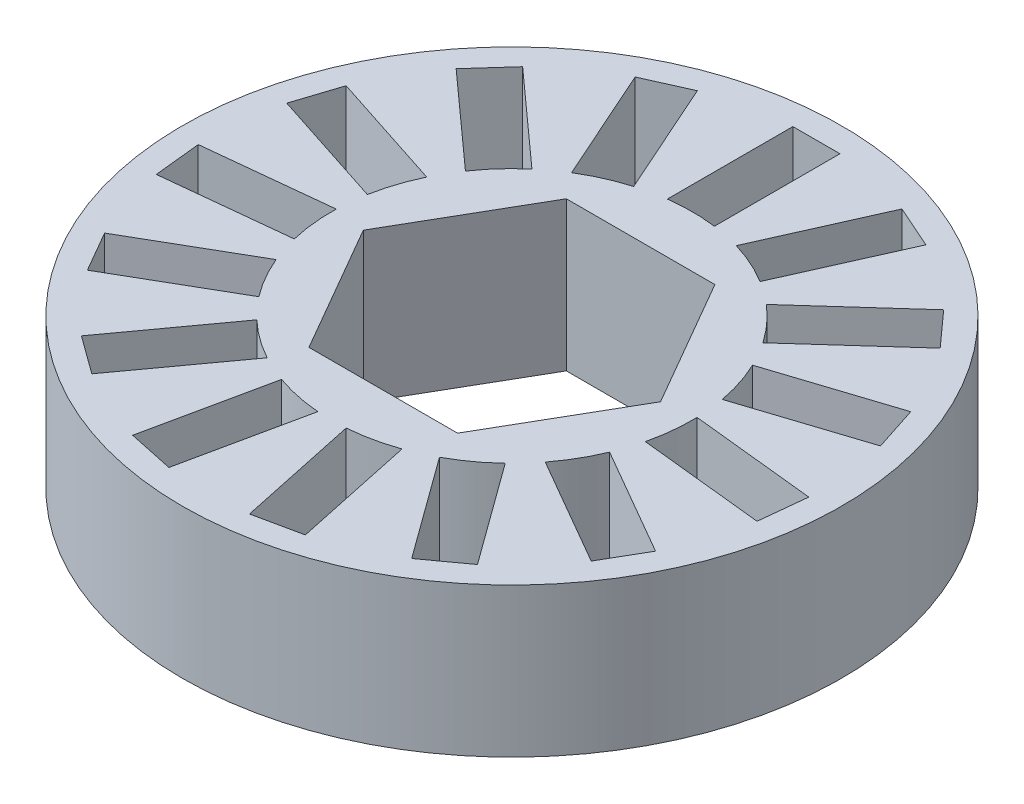
from build123d import *

# Parameters (mm, degrees)
SKETCH1_R           = 10.5
BOSS_EXTRUDE1_DEPTH = 4.75
CUT_EXTRUDE1_DEPTH  = 5
CIRPATTERN1_COUNT   = 15


with BuildPart() as part:
    # Sketch1 → Boss-Extrude1 (new body)
    with BuildSketch(Plane(origin=(0, 0, 0), x_dir=(1, 0, 0), z_dir=(0, 1, 0))):
        with Locations(Location((0, 0, 0), (0, 0, 270))):
            Circle(SKETCH1_R)
        Polygon((4.734272207, 0), (2.367136104, 4.1), (-2.367136104, 4.1), (-4.734272207, 0), (-2.367136104, -4.1), (2.367136104, -4.1), align=None, mode=Mode.SUBTRACT)
    extrude(amount=BOSS_EXTRUDE1_DEPTH)

    # Sketch2 → Cut-Extrude1 (cut)
    with BuildSketch(Plane(origin=(0, 4.75, 0), x_dir=(1, 0, 0), z_dir=(0, 1, 0))):
        with BuildLine():
            Line((0, 5.75), (0, 9.700877125))
            Line((0, 9.700877125), (-0.75, 9.700877125))
            Line((-0.75, 9.700877125), (-0.75, 5.700877125))
            ThreePointArc((-0.75, 5.700877125), (-0.375803491, 5.737706139), (0, 5.75))
        make_face()
        with BuildLine():
            Line((0.75, 9.700877125), (0, 9.700877125))
            Line((0, 9.700877125), (0, 5.75))
            ThreePointArc((0, 5.75), (0.375803491, 5.737706139), (0.75, 5.700877125))
            Line((0.75, 5.700877125), (0.75, 9.700877125))
        make_face()
    cut_extrude1 = extrude(amount=-CUT_EXTRUDE1_DEPTH, mode=Mode.SUBTRACT)

    # CirPattern1: Cut-Extrude1 ×15 about axis
    cirpattern1_axis = Axis((0, 0, 0), (0, 1, 0))
    for i in range(1, CIRPATTERN1_COUNT):
        add(cut_extrude1.rotate(cirpattern1_axis, i * 360 / CIRPATTERN1_COUNT), mode=Mode.SUBTRACT)


solid = part.part
